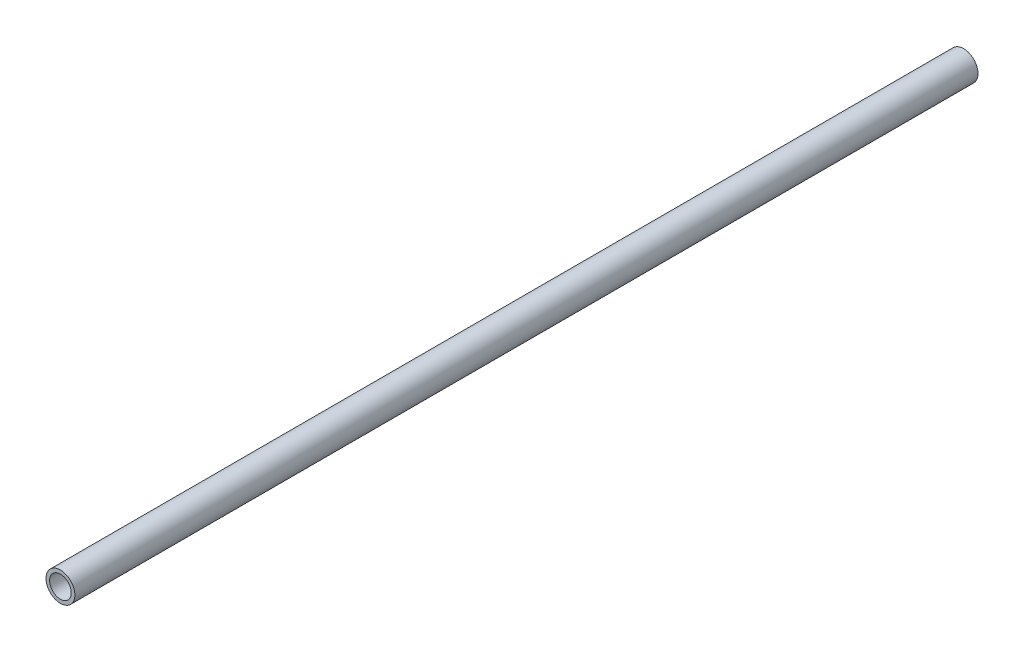
from build123d import *

# Parameters (mm, degrees)
SKETCH1_R           = 4
SKETCH1_R_2         = 3
BOSS_EXTRUDE1_DEPTH = 250


with BuildPart() as part:
    # Sketch1 → Boss-Extrude1 (new body)
    with BuildSketch(Plane.XY):
        Circle(SKETCH1_R)
        Circle(SKETCH1_R_2, mode=Mode.SUBTRACT)
    extrude(amount=BOSS_EXTRUDE1_DEPTH)


solid = part.part
